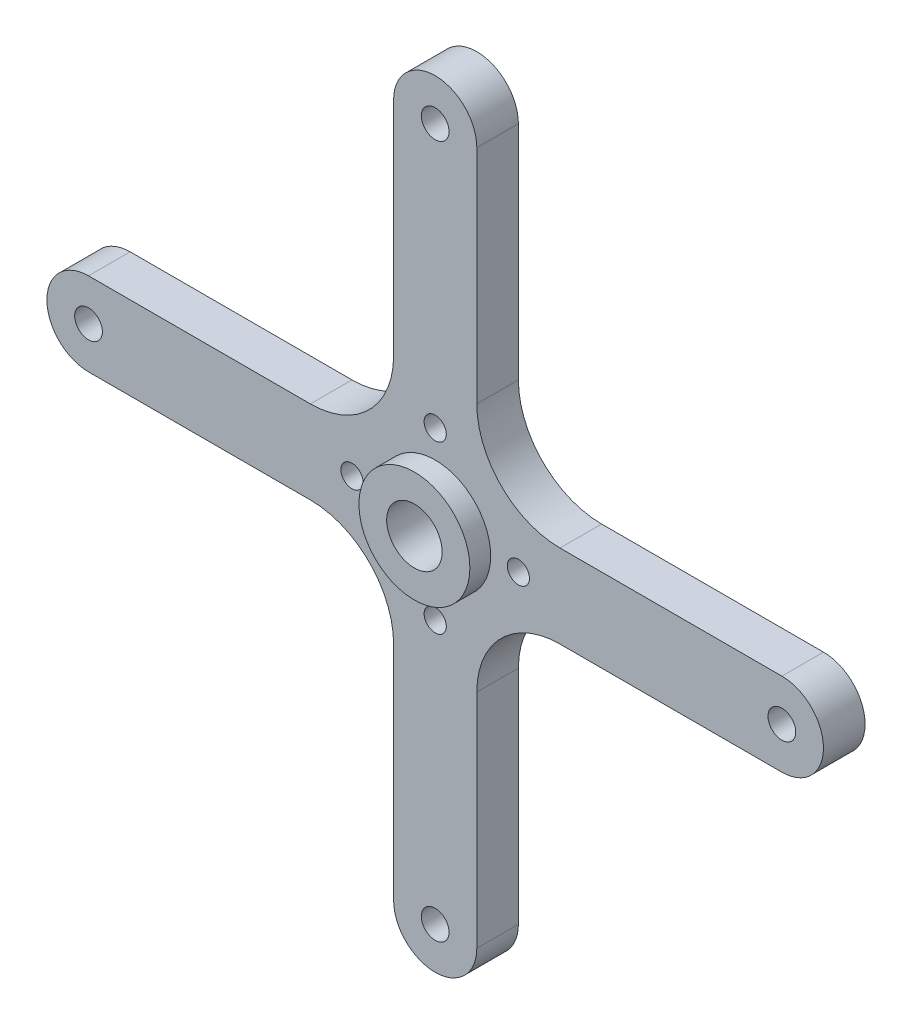
from build123d import *

# Parameters (mm, degrees)
SKETCH1_R           = 0.8
BOSS_EXTRUDE1_DEPTH = 3
FILLET1_R           = 6
SKETCH2_R           = 2
CUT_EXTRUDE1_DEPTH  = 3
BOSS_EXTRUDE2_START = 1.5
SKETCH3_R           = 4
SKETCH3_R_2         = 2
BOSS_EXTRUDE2_DEPTH = 1.5
SKETCH4_R           = 1
CUT_EXTRUDE2_DEPTH  = 3


with BuildPart() as part:
    # Sketch1 → Boss-Extrude1 (new body)
    # profile 1 of 2: a face of its own
    with BuildSketch(Plane.XY):
        with BuildLine():
            Line((25, -3), (-25, -3))
            ThreePointArc((-25, -3), (-28, 0), (-25, 3))
            Line((-25, 3), (25, 3))
            ThreePointArc((25, 3), (28, 0), (25, -3))
        make_face()
        with Locations((-6, 0)):
            Circle(SKETCH1_R, mode=Mode.SUBTRACT)
        with Locations((6, 0)):
            Circle(SKETCH1_R, mode=Mode.SUBTRACT)
    # profile 2 of 2: a face of its own
    with BuildSketch(Plane.XY):
        with BuildLine():
            Line((-3, -25), (-3, 25))
            ThreePointArc((-3, 25), (0, 28), (3, 25))
            Line((3, 25), (3, -25))
            ThreePointArc((3, -25), (0, -28), (-3, -25))
        make_face()
        with Locations((0, 6)):
            Circle(SKETCH1_R, mode=Mode.SUBTRACT)
        with Locations((0, -6)):
            Circle(SKETCH1_R, mode=Mode.SUBTRACT)
    extrude(amount=BOSS_EXTRUDE1_DEPTH)

    # Fillet1
    fillet1_edges = [part.edges().sort_by_distance(p)[0] for p in [
        (3, -3, 1.5),
        (-3, -3, 1.5),
        (-3, 3, 1.5),
        (3, 3, 1.5),
    ]]
    fillet(fillet1_edges, radius=FILLET1_R)

    # Sketch2 → Cut-Extrude1 (cut)
    with BuildSketch(Plane.XY.offset(3)):
        Circle(SKETCH2_R)
    extrude(amount=-CUT_EXTRUDE1_DEPTH, mode=Mode.SUBTRACT)

    # Sketch3 → Boss-Extrude2 (add)
    with BuildSketch(Plane.XY.offset(3).offset(BOSS_EXTRUDE2_START)):
        Circle(SKETCH3_R)
        Circle(SKETCH3_R_2, mode=Mode.SUBTRACT)
    extrude(amount=-BOSS_EXTRUDE2_DEPTH)

    # Sketch4 → Cut-Extrude2 (cut)
    with BuildSketch(Plane.XY.offset(3)):
        with Locations((0, 25)):
            Circle(SKETCH4_R)
        with Locations((25, 0)):
            Circle(SKETCH4_R)
        with Locations((0, -25)):
            Circle(SKETCH4_R)
        with Locations((-25, 0)):
            Circle(SKETCH4_R)
    extrude(amount=-CUT_EXTRUDE2_DEPTH, mode=Mode.SUBTRACT)


solid = part.part
